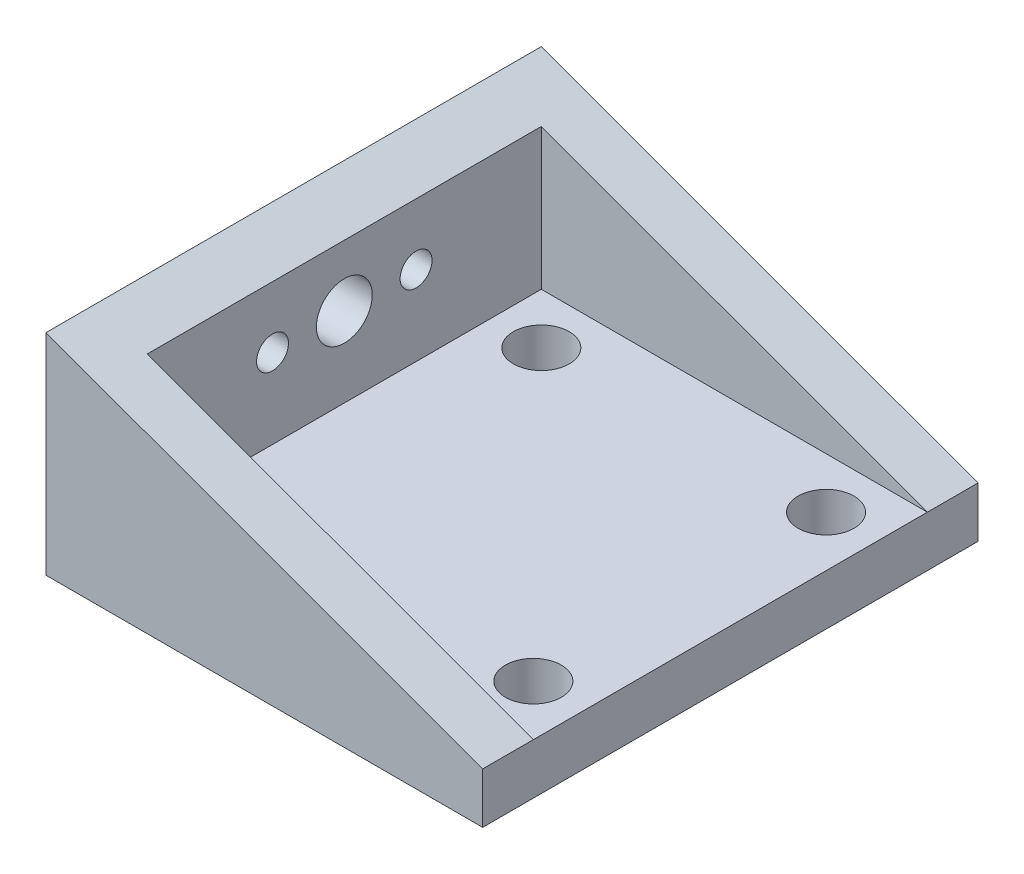
from build123d import *

# Parameters (mm, degrees)
BOSS_EXTRUDE1_DEPTH = 15.524999938
CUT_EXTRUDE1_REACH  = 39.292
CUT_EXTRUDE1_START  = -3.175
SKETCH2_W           = 24.200000114
SKETCH2_H           = 24.699999876
CUT_EXTRUDE2_REACH  = 36.117
SKETCH4_R           = 1.75
SKETCH4_R_2         = 1
CUT_EXTRUDE3_REACH  = 36.117
SKETCH5_R           = 1.7526


with BuildPart() as part:
    # Sketch1 → Boss-Extrude1 (new, symmetric)
    with BuildSketch(Plane.XY):
        Polygon((0, 0), (0, 13.175000066), (27.375000114, 3.175), (27.375000114, 0), align=None)
    extrude(amount=BOSS_EXTRUDE1_DEPTH, both=True)

    # Sketch2 → Cut-Extrude1 (cut, up to next)
    with BuildSketch(Plane.XZ.offset(CUT_EXTRUDE1_START), mode=Mode.PRIVATE) as cut_extrude1_sk1:
        with Locations((15.275000057, 0)):
            Rectangle(SKETCH2_W, SKETCH2_H)
    cut_extrude1_tool1 = extrude(cut_extrude1_sk1.sketch, amount=-CUT_EXTRUDE1_REACH, mode=Mode.PRIVATE) & part.part
    add(cut_extrude1_tool1.solids().sort_by_distance((15.275, 3.175, 0))[0], mode=Mode.SUBTRACT)

    # Sketch4 → Cut-Extrude2 (cut, up to next)
    with BuildSketch(Plane(origin=(0, 0, 0), x_dir=(0, 0, -1), z_dir=(1, 0, 0)), mode=Mode.PRIVATE) as cut_extrude2_sk1:
        with Locations(Location((0, 8.174999906, 0), (0, 0, 180))):
            Circle(SKETCH4_R)
    cut_extrude2_tool1 = extrude(cut_extrude2_sk1.sketch, amount=CUT_EXTRUDE2_REACH, mode=Mode.PRIVATE) & part.part
    # Sketch4 → Cut-Extrude2 (cut, up to next)
    with BuildSketch(Plane(origin=(0, 0, 0), x_dir=(0, 0, -1), z_dir=(1, 0, 0)), mode=Mode.PRIVATE) as cut_extrude2_sk2:
        with Locations(Location((-4.5, 8.174999906, 0), (0, 0, 180))):
            Circle(SKETCH4_R_2)
    cut_extrude2_tool2 = extrude(cut_extrude2_sk2.sketch, amount=CUT_EXTRUDE2_REACH, mode=Mode.PRIVATE) & part.part
    # Sketch4 → Cut-Extrude2 (cut, up to next)
    with BuildSketch(Plane(origin=(0, 0, 0), x_dir=(0, 0, -1), z_dir=(1, 0, 0)), mode=Mode.PRIVATE) as cut_extrude2_sk3:
        with Locations(Location((4.5, 8.174999906, 0), (0, 0, 180))):
            Circle(SKETCH4_R_2)
    cut_extrude2_tool3 = extrude(cut_extrude2_sk3.sketch, amount=CUT_EXTRUDE2_REACH, mode=Mode.PRIVATE) & part.part
    add(cut_extrude2_tool1.solids().sort_by_distance((0, 8.175, 0))[0], mode=Mode.SUBTRACT)
    add(cut_extrude2_tool2.solids().sort_by_distance((0, 8.175, 4.5))[0], mode=Mode.SUBTRACT)
    add(cut_extrude2_tool3.solids().sort_by_distance((0, 8.175, -4.5))[0], mode=Mode.SUBTRACT)

    # Sketch5 → Cut-Extrude3 (cut, up to next)
    with BuildSketch(Plane(origin=(0, 0, 0), x_dir=(1, 0, 0), z_dir=(0, 1, 0)), mode=Mode.PRIVATE) as cut_extrude3_sk1:
        with Locations(Location((6.35, -9.174999938, 0), (0, 0, 90))):
            Circle(SKETCH5_R)
    cut_extrude3_tool1 = extrude(cut_extrude3_sk1.sketch, amount=CUT_EXTRUDE3_REACH, mode=Mode.PRIVATE) & part.part
    # Sketch5 → Cut-Extrude3 (cut, up to next)
    with BuildSketch(Plane(origin=(0, 0, 0), x_dir=(1, 0, 0), z_dir=(0, 1, 0)), mode=Mode.PRIVATE) as cut_extrude3_sk2:
        with Locations(Location((6.35, 9.174999938, 0), (0, 0, 90))):
            Circle(SKETCH5_R)
    cut_extrude3_tool2 = extrude(cut_extrude3_sk2.sketch, amount=CUT_EXTRUDE3_REACH, mode=Mode.PRIVATE) & part.part
    # Sketch5 → Cut-Extrude3 (cut, up to next)
    with BuildSketch(Plane(origin=(0, 0, 0), x_dir=(1, 0, 0), z_dir=(0, 1, 0)), mode=Mode.PRIVATE) as cut_extrude3_sk3:
        with Locations(Location((24.200000114, -9.174999938, 0), (0, 0, 90))):
            Circle(SKETCH5_R)
    cut_extrude3_tool3 = extrude(cut_extrude3_sk3.sketch, amount=CUT_EXTRUDE3_REACH, mode=Mode.PRIVATE) & part.part
    # Sketch5 → Cut-Extrude3 (cut, up to next)
    with BuildSketch(Plane(origin=(0, 0, 0), x_dir=(1, 0, 0), z_dir=(0, 1, 0)), mode=Mode.PRIVATE) as cut_extrude3_sk4:
        with Locations(Location((24.200000114, 9.174999938, 0), (0, 0, 90))):
            Circle(SKETCH5_R)
    cut_extrude3_tool4 = extrude(cut_extrude3_sk4.sketch, amount=CUT_EXTRUDE3_REACH, mode=Mode.PRIVATE) & part.part
    add(cut_extrude3_tool1.solids().sort_by_distance((6.35, 0, 9.175))[0], mode=Mode.SUBTRACT)
    add(cut_extrude3_tool2.solids().sort_by_distance((6.35, 0, -9.175))[0], mode=Mode.SUBTRACT)
    add(cut_extrude3_tool3.solids().sort_by_distance((24.2, 0, 9.175))[0], mode=Mode.SUBTRACT)
    add(cut_extrude3_tool4.solids().sort_by_distance((24.2, 0, -9.175))[0], mode=Mode.SUBTRACT)


solid = part.part
